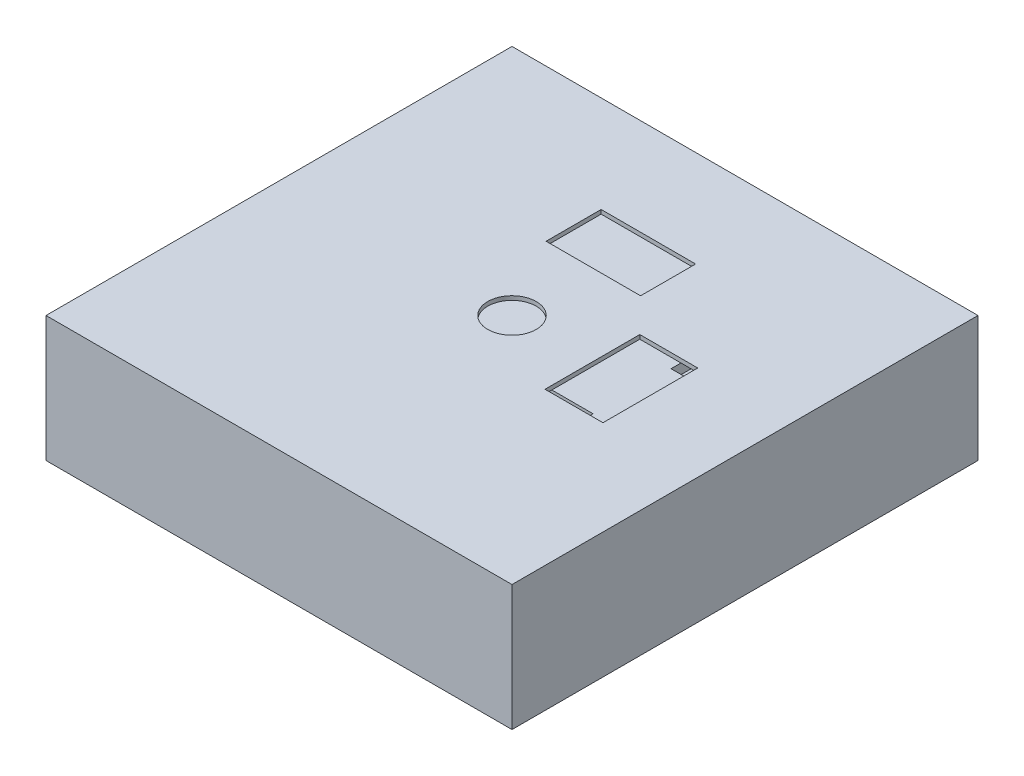
from build123d import *

# Parameters (mm, degrees)
CROQUIS1_W              = 250
CROQUIS1_H              = 250
SALIENTE_EXTRUIR1_DEPTH = 20
CROQUIS2_W              = 15
CROQUIS2_H              = 30
CROQUIS2_W_2            = 30
CROQUIS2_H_2            = 15
CROQUIS2_W_3            = 40
CROQUIS2_H_3            = 40
CORTAR_EXTRUIR1_DEPTH   = 5
CROQUIS3_W              = 250
CROQUIS3_H              = 250
CROQUIS3_W_2            = 200
CROQUIS3_H_2            = 200
CORTAR_EXTRUIR2_DEPTH   = 20
CROQUIS4_W              = 200
CROQUIS4_H              = 200
SALIENTE_EXTRUIR2_DEPTH = 20
CROQUIS5_W              = 220
CROQUIS5_H              = 220
SALIENTE_EXTRUIR3_DEPTH = 40
CROQUIS6_W              = 230
CROQUIS6_H              = 230
SALIENTE_EXTRUIR4_DEPTH = 2
CORTAR_EXTRUIR5_REACH   = 176.052
CROQUIS8_R              = 9.175009618
CROQUIS8_W              = 28.599511609
CROQUIS8_H              = 46.78347923
CROQUIS8_W_2            = 46.633839802
CROQUIS8_H_2            = 27.159350596
CORTAR_EXTRUIR4_REACH   = 176.052
CROQUIS10_R             = 11.959510452


with BuildPart() as part:
    # Croquis1 → Saliente-Extruir1 (new body)
    with BuildSketch(Plane(origin=(0, 0, 0), x_dir=(1, 0, 0), z_dir=(0, 1, 0))):
        Rectangle(CROQUIS1_W, CROQUIS1_H)
    extrude(amount=SALIENTE_EXTRUIR1_DEPTH)

    # Croquis2 → Cortar-Extruir1 (cut)
    with BuildSketch(Plane(origin=(0, 20, 0), x_dir=(1, 0, 0), z_dir=(0, 1, 0))):
        with Locations((27.5, 73.5)):
            Rectangle(CROQUIS2_W, CROQUIS2_H)
        with Locations((73.5, -27.5)):
            Rectangle(CROQUIS2_W_2, CROQUIS2_H_2)
        Rectangle(CROQUIS2_W_3, CROQUIS2_H_3)
    extrude(amount=-CORTAR_EXTRUIR1_DEPTH, mode=Mode.SUBTRACT)

    # Croquis3 → Cortar-Extruir2 (cut)
    with BuildSketch(Plane(origin=(0, 20, 0), x_dir=(1, 0, 0), z_dir=(0, 1, 0))):
        Rectangle(CROQUIS3_W, CROQUIS3_H)
        Rectangle(CROQUIS3_W_2, CROQUIS3_H_2, mode=Mode.SUBTRACT)
    extrude(amount=-CORTAR_EXTRUIR2_DEPTH, mode=Mode.SUBTRACT)

    # Croquis4 → Saliente-Extruir2 (add)
    with BuildSketch(Plane.XZ):
        Polygon((115, -96.500184321), (115, -115), (-115, -115), (-115, -98.664064905), (-115, 115), (-100, 115), (115, 115), (115, 96.335935095), align=None)
        Rectangle(CROQUIS4_W, CROQUIS4_H, mode=Mode.SUBTRACT)
    extrude(amount=-SALIENTE_EXTRUIR2_DEPTH)

    # Croquis5 → Saliente-Extruir3 (add)
    with BuildSketch(Plane(origin=(0, 20, 0), x_dir=(1, 0, 0), z_dir=(0, 1, 0))):
        Polygon((115, 115), (-115, 115), (-115, 110.241153541), (-115, -107.327290452), (-115, -115), (-108.298578148, -115), (115, -115), (115, -107.327290452), (115, 110.241153541), align=None)
        Rectangle(CROQUIS5_W, CROQUIS5_H, mode=Mode.SUBTRACT)
    extrude(amount=SALIENTE_EXTRUIR3_DEPTH)

    # Croquis6 → Saliente-Extruir4 (add)
    with BuildSketch(Plane(origin=(0, 60, 0), x_dir=(1, 0, 0), z_dir=(0, 1, 0))):
        Rectangle(CROQUIS6_W, CROQUIS6_H)
    extrude(amount=SALIENTE_EXTRUIR4_DEPTH)

    # Croquis8 → Cortar-Extruir5 (cut, up to next)
    with BuildSketch(Plane(origin=(0, 62, 0), x_dir=(1, 0, 0), z_dir=(0, 1, 0)), mode=Mode.PRIVATE) as cortar_extruir5_sk1:
        with Locations(Location((0, 0, 0), (0, 0, 270))):
            Circle(CROQUIS8_R)
    cortar_extruir5_tool1 = extrude(cortar_extruir5_sk1.sketch, amount=-CORTAR_EXTRUIR5_REACH, mode=Mode.PRIVATE) & part.part
    # Croquis8 → Cortar-Extruir5 (cut, up to next)
    with BuildSketch(Plane(origin=(0, 62, 0), x_dir=(1, 0, 0), z_dir=(0, 1, 0)), mode=Mode.PRIVATE) as cortar_extruir5_sk2:
        with Locations((53.986056935, 0)):
            Rectangle(CROQUIS8_W, CROQUIS8_H)
    cortar_extruir5_tool2 = extrude(cortar_extruir5_sk2.sketch, amount=-CORTAR_EXTRUIR5_REACH, mode=Mode.PRIVATE) & part.part
    # Croquis8 → Cortar-Extruir5 (cut, up to next)
    with BuildSketch(Plane(origin=(0, 62, 0), x_dir=(1, 0, 0), z_dir=(0, 1, 0)), mode=Mode.PRIVATE) as cortar_extruir5_sk3:
        with Locations((0, 53.729056372)):
            Rectangle(CROQUIS8_W_2, CROQUIS8_H_2)
    cortar_extruir5_tool3 = extrude(cortar_extruir5_sk3.sketch, amount=-CORTAR_EXTRUIR5_REACH, mode=Mode.PRIVATE) & part.part
    add(cortar_extruir5_tool1.solids().sort_by_distance((0, 62, 0))[0], mode=Mode.SUBTRACT)
    add(cortar_extruir5_tool2.solids().sort_by_distance((53.986057, 62, 0))[0], mode=Mode.SUBTRACT)
    add(cortar_extruir5_tool3.solids().sort_by_distance((0, 62, -53.729056))[0], mode=Mode.SUBTRACT)

    # Croquis10 → Cortar-Extruir4 (cut, up to next)
    with BuildSketch(Plane(origin=(0, 62, 0), x_dir=(1, 0, 0), z_dir=(0, 1, 0)), mode=Mode.PRIVATE) as cortar_extruir4_sk1:
        with Locations(Location((0, 0, 0), (0, 0, 270))):
            Circle(CROQUIS10_R)
    cortar_extruir4_tool1 = extrude(cortar_extruir4_sk1.sketch, amount=-CORTAR_EXTRUIR4_REACH, mode=Mode.PRIVATE) & part.part
    add(cortar_extruir4_tool1.solids().sort_by_distance((0, 62, 0))[0], mode=Mode.SUBTRACT)


solid = part.part
